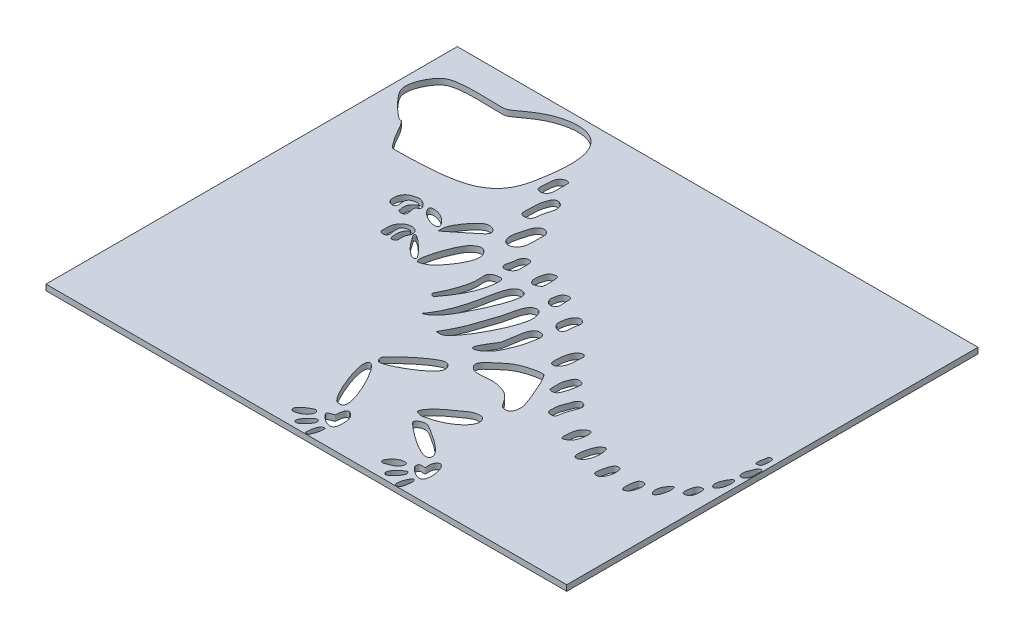
from build123d import *

# Parameters (mm, degrees)
BOSS_EXTRUDE1_DEPTH = 3.81
CUT_EXTRUDE2_DEPTH  = 224.140655074
CUT_EXTRUDE3_DEPTH  = 224.140655216


with BuildPart() as part:
    # Sketch1 → Boss-Extrude1 (new body)
    with BuildSketch(Plane(origin=(0, 0, 0), x_dir=(1, 0, 0), z_dir=(0, 1, 0))):
        Polygon((-169.545, -133.35), (169.545, -133.35), (169.545, 133.35), (169.545, 138.62230863), (-174.81730863, 138.62230863), (-174.81730863, -133.35), align=None)
    extrude(amount=BOSS_EXTRUDE1_DEPTH)

    # Sketch3 → Cut-Extrude2 (cut, through all)
    # profile 1 of 43: a face of its own
    with BuildSketch(Plane(origin=(0, 0, 0), x_dir=(1, 0, 0), z_dir=(0, 1, 0))):
        with BuildLine():
            add(Edge.make_bspline(
                [(-91.542015137, 37.322586792), (-91.65391835, 37.219614613), (-92.324533852, 36.146463954), (-89.862618928, 33.26958076), (-88.397020408, 31.932246621), (-84.173488223, 29.166918066), (-80.500148871, 28.584411737), (-77.971892345, 28.576736995), (-77.500470157, 31.347814716), (-83.496356819, 37.776390769), (-90.724073696, 38.075248049), (-91.542015137, 37.322586792)],
                knots=[0, 0, 0, 0, 0.019939008, 0.179451075, 0.222926196, 0.411215099, 0.451326174, 0.583925878, 0.625876608, 0.854258507, 1, 1, 1, 1], degree=3))
        make_face()
    # profile 2 of 43: a face of its own
    with BuildSketch(Plane(origin=(0, 0, 0), x_dir=(1, 0, 0), z_dir=(0, 1, 0))):
        with BuildLine():
            add(Edge.make_bspline(
                [(-64.465605753, 97.049360345), (-64.928481215, 96.690967494), (-66.440993777, 95.031911487), (-66.815282803, 90.607274201), (-67.28383934, 84.457199381), (-65.528344237, 82.73119463), (-60.948383615, 82.850152494), (-59.773156229, 86.583595001), (-59.873229938, 90.276527545), (-59.677474439, 94.762438544), (-59.777732328, 98.368239523), (-62.727108786, 98.395434907), (-64.465605753, 97.049360345)],
                knots=[0, 0, 0, 0, 0.04219084, 0.15370728, 0.286877941, 0.316430135, 0.449229221, 0.62682008, 0.664290155, 0.806192211, 0.841536971, 1, 1, 1, 1], degree=3))
        make_face()
    # profile 3 of 43: a face of its own
    with BuildSketch(Plane(origin=(0, 0, 0), x_dir=(1, 0, 0), z_dir=(0, 1, 0))):
        with BuildLine():
            add(Edge.make_bspline(
                [(14.503008104, -40.123351811), (14.784918609, -40.408632474), (17.681416759, -43.050216888), (26.977765283, -40.475629658), (36.88783772, -42.795077294), (39.946429394, -44.146076589), (45.121333433, -50.759226507), (46.423695951, -54.222078387), (52.745494658, -52.610973212), (53.448683375, -47.206065657), (51.877457911, -41.203269932), (43.388632106, -20.868490404), (39.242700075, -19.987344993), (27.594806512, -22.481963104), (14.200074455, -33.855216622), (10.967115451, -36.545188591), (14.503008104, -40.123351811)],
                knots=[0, 0, 0, 0, 0.015837931, 0.142541383, 0.177931603, 0.334349907, 0.366262752, 0.465147213, 0.48406968, 0.53656496, 0.553468887, 0.636205025, 0.659820232, 0.766005755, 0.801351051, 1, 1, 1, 1], degree=3))
        make_face()
    # profile 4 of 43: a face of its own
    with BuildSketch(Plane(origin=(0, 0, 0), x_dir=(1, 0, 0), z_dir=(0, 1, 0))):
        with BuildLine():
            add(Edge.make_bspline(
                [(21.227935875, -83.730440807), (21.300473309, -83.791267604), (22.056313977, -84.275855241), (24.632048988, -84.927808514), (29.747397872, -83.57190053), (39.153458634, -81.185635396), (48.294927234, -71.776271451), (47.274908615, -67.058025129), (46.563599695, -65.125405624), (39.333905034, -64.728189349), (34.694670706, -69.426364932), (26.004696402, -74.957304988), (19.386944274, -82.18666381), (21.227935875, -83.730440807)],
                knots=[0, 0, 0, 0, 0.008450928, 0.076058351, 0.110192488, 0.341341371, 0.49116735, 0.514894615, 0.571534092, 0.596921116, 0.743377838, 0.785516435, 1, 1, 1, 1], degree=3))
        make_face()
    # profile 5 of 43: a face of its own
    with BuildSketch(Plane(origin=(0, 0, 0), x_dir=(1, 0, 0), z_dir=(0, 1, 0))):
        with BuildLine():
            add(Edge.make_bspline(
                [(0.528348946, 25.886998649), (0.505540723, 25.710982939), (0.282642067, 24.005189775), (2.570621522, 20.257693993), (6.987295331, 21.591947819), (7.654316072, 25.318925865), (7.250886278, 29.954541047), (7.168397685, 32.122361022), (5.397084842, 32.614817048), (1.223182713, 31.499890851), (0.808439781, 28.048516774), (0.528348946, 25.886998649)],
                knots=[0, 0, 0, 0, 0.02018473, 0.201847299, 0.395048739, 0.435785721, 0.589946966, 0.620753891, 0.713048045, 0.752126333, 1, 1, 1, 1], degree=3))
        make_face()
    # profile 6 of 43: a face of its own
    with BuildSketch(Plane(origin=(0, 0, 0), x_dir=(1, 0, 0), z_dir=(0, 1, 0))):
        with BuildLine():
            add(Edge.make_bspline(
                [(-16.11464107, 29.900272665), (-15.995954189, 29.474736773), (-14.458742174, 25.867545804), (-10.399312478, 28.553035005), (-8.800854843, 29.81754613), (-8.968295772, 38.356758859), (-10.089860529, 40.6949049), (-14.393975608, 39.512575362), (-16.032752546, 34.67183969), (-16.647643111, 31.811279982), (-16.11464107, 29.900272665)],
                knots=[0, 0, 0, 0, 0.042268334, 0.380415008, 0.444917025, 0.622786494, 0.659427082, 0.774682316, 0.810180298, 1, 1, 1, 1], degree=3))
        make_face()
    # profile 7 of 43: a face of its own
    with BuildSketch(Plane(origin=(0, 0, 0), x_dir=(1, 0, 0), z_dir=(0, 1, 0))):
        with BuildLine():
            add(Edge.make_bspline(
                [(-55.897078026, 29.560995971), (-56.281695729, 29.237623882), (-59.892930098, 25.914479253), (-65.348827094, 11.195615076), (-65.892012104, 1.164942712), (-60.702129369, 3.505018313), (-55.699629705, 6.12128485), (-43.745474106, 22.571691345), (-48.718728828, 30.677227321), (-51.981125662, 32.853381338), (-55.897078026, 29.560995971)],
                knots=[0, 0, 0, 0, 0.015507931, 0.139571378, 0.162470174, 0.221597091, 0.288545529, 0.765006118, 0.842107323, 1, 1, 1, 1], degree=3))
        make_face()
    # profile 8 of 43: a face of its own
    with BuildSketch(Plane(origin=(0, 0, 0), x_dir=(1, 0, 0), z_dir=(0, 1, 0))):
        with BuildLine():
            add(Edge.make_bspline(
                [(51.387862225, -114.803893869), (51.382454936, -115.02464443), (51.522810052, -117.252544512), (58.198852632, -121.947186087), (62.294303476, -120.427581674), (63.572660302, -111.464061725), (59.498243913, -104.591906984), (55.321691692, -107.737950785), (55.597026045, -112.859160613), (55.907390911, -113.110216387), (53.563388173, -113.040239128), (51.436528275, -112.817120514), (51.387862225, -114.803893869)],
                knots=[0, 0, 0, 0, 0.017018823, 0.153169411, 0.178134687, 0.249652763, 0.420161936, 0.462199194, 0.67002535, 0.813831713, 0.846829178, 1, 1, 1, 1], degree=3))
        make_face()
    # profile 9 of 43: a face of its own
    with BuildSketch(Plane(origin=(0, 0, 0), x_dir=(1, 0, 0), z_dir=(0, 1, 0))):
        with BuildLine():
            add(Edge.make_bspline(
                [(114.6867528, -59.924818057), (114.729491118, -60.095771327), (115.27666835, -61.237285574), (118.381294228, -61.137338592), (121.421165978, -56.578556254), (121.743281053, -53.534186394), (121.067717316, -48.792781014), (118.753618209, -48.588343635), (116.017751001, -50.429954218), (114.248187844, -58.170558233), (114.6867528, -59.924818057)],
                knots=[0, 0, 0, 0, 0.017057634, 0.153518708, 0.216852434, 0.587061175, 0.650554742, 0.788294535, 0.824960808, 1, 1, 1, 1], degree=3))
        make_face()
    # profile 10 of 43: a face of its own
    with BuildSketch(Plane(origin=(0, 0, 0), x_dir=(1, 0, 0), z_dir=(0, 1, 0))):
        with BuildLine():
            add(Edge.make_bspline(
                [(-4.062132727, -132.417419648), (-4.055925816, -132.460276796), (-3.995496856, -132.83788407), (-2.074927879, -133.311557533), (-0.468516826, -129.379969418), (0.1790829, -127.156761212), (0.38630734, -123.038001402), (-1.777009786, -123.942012355), (-3.322641715, -125.450791586), (-4.366161003, -130.318181466), (-4.062132727, -132.417419648)],
                knots=[0, 0, 0, 0, 0.009256087, 0.083304785, 0.118716357, 0.327960231, 0.368328179, 0.482027886, 0.546616315, 1, 1, 1, 1], degree=3))
        make_face()
    # profile 11 of 43: a face of its own
    with BuildSketch(Plane(origin=(0, 0, 0), x_dir=(1, 0, 0), z_dir=(0, 1, 0))):
        with BuildLine():
            add(Edge.make_bspline(
                [(37.896352596, -11.861878545), (38.021586866, -11.949542534), (39.285826174, -12.170741801), (40.555392075, -12.326721646), (44.832936323, -6.803541624), (44.308296583, -2.390571595), (45.200161781, 4.120933438), (41.900628824, 4.834576407), (37.043512324, -1.087301561), (36.557927918, -10.92498127), (37.896352596, -11.861878545)],
                knots=[0, 0, 0, 0, 0.020780416, 0.187023747, 0.240790841, 0.504684265, 0.55922741, 0.731679145, 0.777912051, 1, 1, 1, 1], degree=3))
        make_face()
    # profile 12 of 43: a face of its own
    with BuildSketch(Plane(origin=(0, 0, 0), x_dir=(1, 0, 0), z_dir=(0, 1, 0))):
        with BuildLine():
            add(Edge.make_bspline(
                [(163.492515477, 6.34287981), (163.324497697, 6.123428016), (162.947928924, 3.256530552), (161.889045776, 0.279355237), (162.840029989, -1.956108104), (163.815199152, -1.498796138), (166.092000241, -0.926971014), (166.292095404, 3.154359675), (166.273456546, 6.687158303), (163.980310696, 6.980000096), (163.492515477, 6.34287981)],
                knots=[0, 0, 0, 0, 0.03326737, 0.299406326, 0.353220498, 0.517594919, 0.573596104, 0.857231157, 0.903416985, 1, 1, 1, 1], degree=3))
        make_face()
    # profile 13 of 43: a face of its own
    with BuildSketch(Plane(origin=(0, 0, 0), x_dir=(1, 0, 0), z_dir=(0, 1, 0))):
        with BuildLine():
            add(Edge.make_bspline(
                [(149.250099333, -41.947484614), (149.112602169, -41.873290304), (147.486566068, -42.154554618), (143.082368883, -48.26832991), (146.687679051, -56.040891514), (150.475980161, -47.460631502), (149.678225908, -42.17850433), (149.250099333, -41.947484614)],
                knots=[0, 0, 0, 0, 0.035839077, 0.358390766, 0.518048392, 0.888407435, 1, 1, 1, 1], degree=3))
        make_face()
    # profile 14 of 43: a face of its own
    with BuildSketch(Plane(origin=(0, 0, 0), x_dir=(1, 0, 0), z_dir=(0, 1, 0))):
        with BuildLine():
            add(Edge.make_bspline(
                [(-79.98393803, 16.753249035), (-80.081010975, 16.804943504), (-80.930915658, 17.23682462), (-81.941957742, 16.697682781), (-75.814186935, 7.703624546), (-72.590575365, 5.316326099), (-69.38511458, 3.007902086), (-67.151603708, 2.99090111), (-67.061756876, 5.770904446), (-76.209431856, 14.74320294), (-79.98393803, 16.753249035)],
                knots=[0, 0, 0, 0, 0.004766014, 0.042894126, 0.109883005, 0.607665921, 0.682309035, 0.781671031, 0.814682152, 1, 1, 1, 1], degree=3))
        make_face()
    # profile 15 of 43: a face of its own
    with BuildSketch(Plane(origin=(0, 0, 0), x_dir=(1, 0, 0), z_dir=(0, 1, 0))):
        with BuildLine():
            add(Edge.make_bspline(
                [(16.803913905, 15.294425326), (16.754957699, 14.823466123), (16.449667367, 10.94963843), (21.405877953, 8.195306275), (24.735032391, 12.315189368), (23.361824106, 12.783664316), (25.658708788, 22.128843056), (22.160061855, 24.127497735), (17.744419103, 21.428220159), (17.043006767, 17.594501107), (16.803913905, 15.294425326)],
                knots=[0, 0, 0, 0, 0.035053188, 0.315478688, 0.385774496, 0.667715456, 0.713640808, 0.799102661, 0.828806853, 1, 1, 1, 1], degree=3))
        make_face()
    # profile 16 of 43: a face of its own
    with BuildSketch(Plane(origin=(0, 0, 0), x_dir=(1, 0, 0), z_dir=(0, 1, 0))):
        with BuildLine():
            add(Edge.make_bspline(
                [(-33.716806314, -25.510766217), (-33.795983845, -25.59262967), (-33.972322493, -25.693579689), (-30.748658466, -26.108813315), (-20.77783359, -13.179075112), (-9.203609991, 12.129244185), (-10.705794687, 20.064484295), (-17.509488953, 21.092286771), (-20.533417018, 13.203205411), (-25.419478303, -15.926894582), (-32.937275102, -24.704791132), (-33.716806314, -25.510766217)],
                knots=[0, 0, 0, 0, 0.029366847, 0.264301623, 0.315128072, 0.486804886, 0.514976536, 0.57538497, 0.668411345, 0.710872848, 1, 1, 1, 1], degree=3))
        make_face()
    # profile 17 of 43: a face of its own
    with BuildSketch(Plane(origin=(0, 0, 0), x_dir=(1, 0, 0), z_dir=(0, 1, 0))):
        with BuildLine():
            add(Edge.make_bspline(
                [(-75.656405604, 26.734733156), (-75.685258919, 26.581397222), (-76.17906958, 26.132819734), (-64.525462372, 35.502113407), (-54.693486016, 43.470265177), (-60.026962236, 47.369309442), (-66.638632959, 45.950973373), (-73.409271294, 36.388761793), (-75.825004315, 30.467137167), (-75.538425057, 27.361720295), (-75.656405604, 26.734733156)],
                knots=[0, 0, 0, 0, 0.035008556, 0.350085557, 0.465041353, 0.595637251, 0.633227651, 0.817865604, 0.856850814, 1, 1, 1, 1], degree=3))
        make_face()
    # profile 18 of 43: a face of its own
    with BuildSketch(Plane(origin=(0, 0, 0), x_dir=(1, 0, 0), z_dir=(0, 1, 0))):
        with BuildLine():
            add(Edge.make_bspline(
                [(155.096829505, -41.695622461), (155.207780619, -43.17127227), (157.821411323, -42.859237855), (159.996207355, -40.754596534), (160.656927203, -40.131757401), (160.662796845, -34.751027581), (160.543788755, -33.219867635), (154.911594471, -32.73358886), (154.983260895, -40.185159946), (155.096829505, -41.695622461)],
                knots=[0, 0, 0, 0, 0.323078917, 0.323078917, 0.615276181, 0.615276181, 0.669299186, 0.669299186, 1, 1, 1, 1], degree=3))
        make_face()
    # profile 19 of 43: a face of its own
    with BuildSketch(Plane(origin=(0, 0, 0), x_dir=(1, 0, 0), z_dir=(0, 1, 0))):
        with BuildLine():
            add(Edge.make_bspline(
                [(133.833634158, -60.416338349), (134.187174924, -60.482704728), (138.169435027, -59.201922768), (139.031280462, -51.605372257), (137.224017338, -49.091489431), (135.53091519, -49.355491983), (133.001548566, -50.565103145), (131.721307256, -60.019814098), (133.833634158, -60.416338349)],
                knots=[0, 0, 0, 0, 0.044939449, 0.404455044, 0.474621361, 0.676436303, 0.731496854, 1, 1, 1, 1], degree=3))
        make_face()
    # profile 20 of 43: a face of its own
    with BuildSketch(Plane(origin=(0, 0, 0), x_dir=(1, 0, 0), z_dir=(0, 1, 0))):
        with BuildLine():
            add(Edge.make_bspline(
                [(-56.542867789, 80.4090043), (-57.360025214, 78.432618613), (-58.194406257, 75.799332909), (-58.028803939, 68.474487513), (-58.986863676, 62.510504472), (-50.550479214, 63.678043941), (-51.45089827, 70.740916465), (-48.809310938, 75.846646023), (-48.957240293, 82.478753936), (-54.550262466, 84.612947751), (-55.936102592, 81.876533097), (-56.542867789, 80.4090043)],
                knots=[0, 0, 0, 0, 0.196712415, 0.227714318, 0.310019024, 0.419059956, 0.530055008, 0.660864195, 0.693252176, 0.853934819, 1, 1, 1, 1], degree=3))
        make_face()
    # profile 21 of 43: a face of its own
    with BuildSketch(Plane(origin=(0, 0, 0), x_dir=(1, 0, 0), z_dir=(0, 1, 0))):
        with BuildLine():
            add(Edge.make_bspline(
                [(-48.508391937, 45.499040123), (-48.379947717, 45.070892724), (-46.797809852, 41.31172592), (-43.023725639, 41.318782715), (-37.414567081, 46.012551944), (-38.007343737, 51.105896691), (-37.486169202, 62.913519191), (-43.281495409, 63.534466695), (-46.324042342, 58.818036159), (-47.064314202, 56.03746806), (-48.457455762, 50.709133163), (-49.153314986, 47.648783622), (-48.508391937, 45.499040123)],
                knots=[0, 0, 0, 0, 0.018862865, 0.169765788, 0.224468424, 0.511186589, 0.5669401, 0.726250019, 0.761023924, 0.87990525, 0.905288874, 1, 1, 1, 1], degree=3))
        make_face()
    # profile 22 of 43: a face of its own
    with BuildSketch(Plane(origin=(0, 0, 0), x_dir=(1, 0, 0), z_dir=(0, 1, 0))):
        with BuildLine():
            add(Edge.make_bspline(
                [(99.468289653, -57.571944512), (100.38729169, -57.988757795), (102.560142419, -57.361954265), (106.795538312, -51.009410446), (106.038905479, -40.492027762), (101.437501136, -43.466570073), (99.422569256, -46.306023928), (97.285986301, -56.582161044), (99.468289653, -57.571944512)],
                knots=[0, 0, 0, 0, 0.115048732, 0.164424759, 0.457167438, 0.517064259, 0.726800135, 1, 1, 1, 1], degree=3))
        make_face()
    # profile 23 of 43: a face of its own
    with BuildSketch(Plane(origin=(0, 0, 0), x_dir=(1, 0, 0), z_dir=(0, 1, 0))):
        with BuildLine():
            add(Edge.make_bspline(
                [(164.508977119, -13.721623532), (164.636894472, -13.84069279), (165.90747669, -14.489105315), (168.210257852, -13.267957268), (169.304803184, -9.944112583), (168.927783157, -6.494696115), (169.066671934, -2.793228643), (165.865254448, -3.115253922), (165.323141054, -6.655725913), (163.39839929, -10.171032453), (163.748447482, -13.013700037), (164.508977119, -13.721623532)],
                knots=[0, 0, 0, 0, 0.025273086, 0.227457777, 0.285534496, 0.547963553, 0.592733479, 0.700430126, 0.819782467, 0.849739455, 1, 1, 1, 1], degree=3))
        make_face()
    # profile 24 of 43: a face of its own
    with BuildSketch(Plane(origin=(0, 0, 0), x_dir=(1, 0, 0), z_dir=(0, 1, 0))):
        with BuildLine():
            add(Edge.make_bspline(
                [(160.661880967, -27.208216991), (160.679526674, -27.340861389), (160.903231282, -28.426409673), (162.615031879, -30.031500451), (164.498509592, -27.307766588), (165.696084114, -26.467349911), (166.315844112, -20.26097831), (165.308222188, -16.534954882), (161.360471491, -21.839701376), (160.482281831, -25.858153854), (160.661880967, -27.208216991)],
                knots=[0, 0, 0, 0, 0.019318757, 0.173868812, 0.232992094, 0.551428296, 0.601673612, 0.695640725, 0.803372461, 1, 1, 1, 1], degree=3))
        make_face()
    # profile 25 of 43: a face of its own
    with BuildSketch(Plane(origin=(0, 0, 0), x_dir=(1, 0, 0), z_dir=(0, 1, 0))):
        with BuildLine():
            add(Edge.make_bspline(
                [(-23.364075202, -71.605579889), (-23.694004458, -71.90397718), (-25.945628569, -76.754279406), (-14.824389788, -103.344156371), (-9.385384732, -105.166691161), (-6.182117533, -104.826126296), (-7.529771535, -92.024141264), (-20.125445229, -68.676471934), (-23.364075202, -71.605579889)],
                knots=[0, 0, 0, 0, 0.039948341, 0.359535068, 0.415964147, 0.547810052, 0.607861711, 1, 1, 1, 1], degree=3))
        make_face()
    # profile 26 of 43: a face of its own
    with BuildSketch(Plane(origin=(0, 0, 0), x_dir=(1, 0, 0), z_dir=(0, 1, 0))):
        with BuildLine():
            add(Edge.make_bspline(
                [(64.166924047, -39.25050065), (64.168506595, -39.396095037), (64.187957897, -40.885006937), (69.503167719, -42.172708808), (69.748225136, -38.199952527), (71.072778473, -31.805800156), (73.662890804, -27.536148012), (72.528725749, -24.612319278), (68.029972196, -22.438639865), (65.104519885, -32.751817814), (64.098261992, -32.933591609), (64.166924047, -39.25050065)],
                knots=[0, 0, 0, 0, 0.00740117, 0.074011699, 0.145377231, 0.175107865, 0.349516909, 0.381549495, 0.47363259, 0.67888517, 1, 1, 1, 1], degree=3))
        make_face()
    # profile 27 of 43: a face of its own
    with BuildSketch(Plane(origin=(0, 0, 0), x_dir=(1, 0, 0), z_dir=(0, 1, 0))):
        with BuildLine():
            add(Edge.make_bspline(
                [(83.62883511, -46.358616375), (83.408736561, -48.437118146), (83.095544077, -52.064796051), (88.758266548, -49.410311789), (90.752310321, -45.298539519), (91.195920449, -36.282309661), (84.532483456, -39.692868448), (84.00649782, -42.792156642), (83.62883511, -46.358616375)],
                knots=[0, 0, 0, 0, 0.14952472, 0.215411048, 0.467106659, 0.650036615, 0.743433515, 1, 1, 1, 1], degree=3))
        make_face()
    # profile 28 of 43: a face of its own
    with BuildSketch(Plane(origin=(0, 0, 0), x_dir=(1, 0, 0), z_dir=(0, 1, 0))):
        with BuildLine():
            add(Edge.make_bspline(
                [(25.497417042, -90.954494738), (25.664827867, -91.489087835), (30.552911299, -96.227292212), (48.486382242, -109.380433835), (54.725302478, -102.045838071), (39.539129351, -91.98322093), (30.012026201, -86.519823842), (24.955438972, -89.223795815), (25.497417042, -90.954494738)],
                knots=[0, 0, 0, 0, 0.038709293, 0.348383636, 0.434459415, 0.813391305, 0.874682012, 1, 1, 1, 1], degree=3))
        make_face()
    # profile 29 of 43: a face of its own
    with BuildSketch(Plane(origin=(0, 0, 0), x_dir=(1, 0, 0), z_dir=(0, 1, 0))):
        with BuildLine():
            add(Edge.make_bspline(
                [(4.051690369, -29.187445569), (4.379148576, -29.128001778), (7.870292683, -28.110765579), (12.468562593, -23.113351284), (16.629210697, -13.49025151), (18.176731192, -9.419349569), (19.940882766, 2.523261344), (15.198444153, 2.682902044), (10.757919011, -0.108618811), (10.645338166, -7.422098379), (8.258097358, -18.644881305), (9.97745686, -13.330416283), (0.932009995, -29.753764025), (4.051690369, -29.187445569)],
                knots=[0, 0, 0, 0, 0.008074965, 0.072674686, 0.099349961, 0.24815244, 0.27522562, 0.343008583, 0.384517974, 0.648810145, 0.705969015, 0.923070152, 1, 1, 1, 1], degree=3))
        make_face()
    # profile 30 of 43: a face of its own
    with BuildSketch(Plane(origin=(0, 0, 0), x_dir=(1, 0, 0), z_dir=(0, 1, 0))):
        with BuildLine():
            add(Edge.make_bspline(
                [(-14.331361336, -128.330665924), (-14.348704903, -128.459779145), (-14.402513724, -129.56547153), (-12.915760325, -130.361208959), (-9.85656431, -128.711061811), (-6.546091977, -124.729998531), (-6.115750506, -122.795474684), (-6.402967037, -121.387883004), (-8.703491355, -120.2501599), (-13.996507461, -125.837864856), (-14.331361336, -128.330665924)],
                knots=[0, 0, 0, 0, 0.015961604, 0.143654439, 0.194995899, 0.478034742, 0.527831783, 0.643169269, 0.691827809, 1, 1, 1, 1], degree=3))
        make_face()
    # profile 31 of 43: a face of its own
    with BuildSketch(Plane(origin=(0, 0, 0), x_dir=(1, 0, 0), z_dir=(0, 1, 0))):
        with BuildLine():
            add(Edge.make_bspline(
                [(-94.210826462, 34.03206876), (-93.778868206, 35.565427326), (-97.971608348, 39.889797899), (-105.04532316, 38.256139321), (-109.262624582, 36.339915398), (-110.014173652, 26.560828394), (-102.197140196, 25.93291178), (-105.239181187, 33.828881051), (-101.408424888, 35.947325289), (-98.038525023, 36.043633356), (-96.765829547, 35.429407157), (-97.223215311, 34.525777818), (-101.091935193, 32.411883608), (-100.879123663, 28.049951437), (-100.076511258, 24.388555366), (-93.782562734, 24.75578378), (-96.873371051, 29.781422296), (-96.158039742, 32.878034999), (-94.434404055, 33.238416566), (-94.210826462, 34.03206876)],
                knots=[0, 0, 0, 0, 0.094856815, 0.116602415, 0.217456002, 0.292256507, 0.349905874, 0.420597596, 0.490923361, 0.502433042, 0.531998702, 0.545686405, 0.635614364, 0.729475404, 0.747475955, 0.81561987, 0.932464978, 0.950902991, 1, 1, 1, 1], degree=3))
        make_face()
    # profile 32 of 43: a face of its own
    with BuildSketch(Plane(origin=(0, 0, 0), x_dir=(1, 0, 0), z_dir=(0, 1, 0))):
        with BuildLine():
            add(Edge.make_bspline(
                [(-32.296392677, 19.815291487), (-32.743265322, 19.611297579), (-36.049599472, 17.573556984), (-32.14109701, 11.124366865), (-39.587678183, -7.107494929), (-42.387618115, -11.275585907), (-39.793500224, -12.903958032), (-37.686612077, -9.871203555), (-27.514981128, 2.832637203), (-25.802626652, 19.536052323), (-28.375004488, 21.094564998), (-31.060179705, 20.379613152), (-32.296392677, 19.815291487)],
                knots=[0, 0, 0, 0, 0.025581572, 0.255815716, 0.500363414, 0.535000104, 0.594717894, 0.623341296, 0.813769401, 0.910608969, 0.929232029, 1, 1, 1, 1], degree=3))
        make_face()
    # profile 33 of 43: a face of its own
    with BuildSketch(Plane(origin=(0, 0, 0), x_dir=(1, 0, 0), z_dir=(0, 1, 0))):
        with BuildLine():
            add(Edge.make_bspline(
                [(-34.156804193, 28.821109473), (-34.096521909, 28.552216051), (-33.10153179, 25.785483769), (-26.335462911, 27.898336909), (-26.828655281, 34.685333217), (-26.297707828, 41.042372118), (-32.106437564, 40.446546104), (-33.133040078, 36.103895352), (-33.361864835, 31.919022497), (-34.501041184, 30.356603084), (-34.156804193, 28.821109473)],
                knots=[0, 0, 0, 0, 0.023977596, 0.239775963, 0.366940947, 0.500447341, 0.700245757, 0.833102498, 0.863077923, 1, 1, 1, 1], degree=3))
        make_face()
    # profile 34 of 43: a face of its own
    with BuildSketch(Plane(origin=(0, 0, 0), x_dir=(1, 0, 0), z_dir=(0, 1, 0))):
        with BuildLine():
            add(Edge.make_bspline(
                [(37.731420674, -121.996558791), (37.640202855, -122.154746655), (36.826967853, -123.614772993), (38.514858827, -124.757899796), (42.329418833, -123.130014526), (46.991296946, -122.172807504), (47.605359889, -116.752003995), (43.953987237, -116.128715108), (40.276714704, -117.582567879), (37.731420674, -121.996558791)],
                knots=[0, 0, 0, 0, 0.012393179, 0.111538615, 0.16164663, 0.501080148, 0.604295256, 0.654187241, 1, 1, 1, 1], degree=3))
        make_face()
    # profile 35 of 43: a face of its own
    with BuildSketch(Plane(origin=(0, 0, 0), x_dir=(1, 0, 0), z_dir=(0, 1, 0))):
        with BuildLine():
            add(Edge.make_bspline(
                [(45.262403398, -128.069825788), (45.235297006, -128.165666247), (45.011462115, -129.034746232), (46.1881916, -130.602872315), (48.942998782, -129.314572062), (51.948054537, -126.270149073), (53.458300274, -122.528744044), (52.315598044, -120.644263754), (48.619061476, -123.189465498), (45.984183052, -125.517819155), (45.262403398, -128.069825788)],
                knots=[0, 0, 0, 0, 0.014619941, 0.131579469, 0.176264738, 0.416787361, 0.458912449, 0.555390528, 0.610705259, 1, 1, 1, 1], degree=3))
        make_face()
    # profile 36 of 43: a face of its own
    with BuildSketch(Plane(origin=(0, 0, 0), x_dir=(1, 0, 0), z_dir=(0, 1, 0))):
        with BuildLine():
            add(Edge.make_bspline(
                [(-21.568989617, -63.743442059), (-21.660736115, -63.849561767), (-22.365187762, -64.678646665), (-21.551626997, -67.986190401), (-15.443103305, -67.98079859), (6.185601351, -55.93173735), (6.024944033, -48.258298832), (3.052508677, -44.763006251), (-10.004307568, -51.224699281), (-19.575391382, -61.437522292), (-21.568989617, -63.743442059)],
                knots=[0, 0, 0, 0, 0.014580203, 0.131221828, 0.185135605, 0.499804195, 0.55002184, 0.63709441, 0.683180633, 1, 1, 1, 1], degree=3))
        make_face()
    # profile 37 of 43: a face of its own
    with BuildSketch(Plane(origin=(0, 0, 0), x_dir=(1, 0, 0), z_dir=(0, 1, 0))):
        with BuildLine():
            add(Edge.make_bspline(
                [(-82.314922661, 16.753249035), (-82.383878665, 17.751158861), (-83.559677059, 20.896079441), (-88.30581655, 20.766636749), (-92.451412596, 18.628269782), (-94.475335864, 15.347042899), (-94.414040672, 10.390296426), (-94.806744403, 7.438220669), (-92.948660697, 6.821567639), (-90.978201797, 6.663028114), (-88.69498132, 9.382893521), (-90.7529198, 10.949057132), (-89.789435433, 17.576805895), (-82.628118517, 18.127069137), (-88.326221601, 16.02127275), (-87.864825992, 6.718148999), (-85.515175124, 6.579651856), (-83.862281231, 7.50213238), (-83.719520576, 10.319262502), (-84.214818349, 13.436026652), (-82.21100909, 15.249444172), (-82.314922661, 16.753249035)],
                knots=[0, 0, 0, 0, 0.047068315, 0.11231218, 0.130974699, 0.222280304, 0.240811144, 0.297752264, 0.310302931, 0.353767144, 0.375791751, 0.5085244, 0.532567077, 0.599626945, 0.665496137, 0.752070288, 0.767913803, 0.817707129, 0.834445184, 0.929070183, 1, 1, 1, 1], degree=3))
        make_face()
    # profile 38 of 43: a face of its own
    with BuildSketch(Plane(origin=(0, 0, 0), x_dir=(1, 0, 0), z_dir=(0, 1, 0))):
        with BuildLine():
            add(Edge.make_bspline(
                [(51.954326414, -26.214853249), (51.956569414, -26.354270045), (51.976510184, -27.633767537), (55.369981158, -27.705971171), (58.395839586, -24.73606195), (59.774457896, -16.723190922), (60.112992998, -12.920678418), (54.85256074, -10.974796738), (53.403889375, -14.953383971), (51.687853752, -19.160418705), (51.858549415, -20.261698297), (51.954326414, -26.214853249)],
                knots=[0, 0, 0, 0, 0.006884839, 0.061963551, 0.094777735, 0.302212496, 0.344797669, 0.494700117, 0.655484536, 0.706014524, 1, 1, 1, 1], degree=3))
        make_face()
    # profile 39 of 43: a face of its own
    with BuildSketch(Plane(origin=(0, 0, 0), x_dir=(1, 0, 0), z_dir=(0, 1, 0))):
        with BuildLine():
            add(Edge.make_bspline(
                [(0.28957124, -107.053757633), (-2.308691995, -104.884724033), (-4.299099327, -108.818200527), (-4.225536422, -112.45976951), (-4.399989959, -112.663544572), (-7.447735166, -113.725464194), (-9.438563979, -115.434714117), (-1.307245601, -122.152633545), (3.370438052, -119.363425445), (3.278488492, -114.698567828), (2.70652962, -109.541471075), (1.233741225, -107.84195199), (0.28957124, -107.053757633)],
                knots=[0, 0, 0, 0, 0.224541592, 0.449658485, 0.483563932, 0.554703602, 0.584878077, 0.755134209, 0.789708485, 0.896046568, 0.918404945, 1, 1, 1, 1], degree=3))
        make_face()
    # profile 40 of 43: a face of its own
    with BuildSketch(Plane(origin=(0, 0, 0), x_dir=(1, 0, 0), z_dir=(0, 1, 0))):
        with BuildLine():
            add(Edge.make_bspline(
                [(58.312887738, -123.422779511), (58.083347813, -123.455305247), (56.710105892, -125.242402943), (54.820065602, -129.226849343), (55.352246188, -132.735007236), (56.485014413, -133.368005938), (59.390378071, -131.546074626), (59.240451204, -128.95565236), (59.945853838, -124.279977972), (58.783226509, -123.356132653), (58.312887738, -123.422779511)],
                knots=[0, 0, 0, 0, 0.045548698, 0.409938285, 0.466513374, 0.5547245, 0.598805629, 0.863243531, 0.906668442, 1, 1, 1, 1], degree=3))
        make_face()
    # profile 41 of 43: a face of its own
    with BuildSketch(Plane(origin=(0, 0, 0), x_dir=(1, 0, 0), z_dir=(0, 1, 0))):
        with BuildLine():
            add(Edge.make_bspline(
                [(-21.847744238, -121.996558791), (-22.229639471, -122.967119181), (-21.53627492, -124.443974361), (-17.853217568, -124.488200499), (-12.520427048, -121.78179093), (-11.919408837, -116.922031449), (-13.406657796, -115.673292231), (-17.093180118, -117.471720549), (-20.294620736, -119.465457054), (-21.746772149, -121.739945193), (-21.847744238, -121.996558791)],
                knots=[0, 0, 0, 0, 0.126684623, 0.182310092, 0.51470529, 0.567134142, 0.654169757, 0.698544288, 0.966504921, 1, 1, 1, 1], degree=3))
        make_face()
    # profile 42 of 43: a face of its own
    with BuildSketch(Plane(origin=(0, 0, 0), x_dir=(1, 0, 0), z_dir=(0, 1, 0))):
        with BuildLine():
            Line((-18.663665482, -31.590942523), (-15.653411961, -31.590942523))
            add(Edge.make_bspline(
                [(-15.653411961, -31.590942523), (-10.285376125, -31.914622908), (6.578012984, -2.173647935), (5.850893328, 11.601493139), (3.72843688, 15.057604688), (-3.805047217, 14.041138452), (-4.488974589, 2.72896218), (-11.887709825, -17.025086616), (-10.88729594, -17.969812468), (-18.663665482, -31.590942523)],
                knots=[0, 0, 0, 0, 0.255506378, 0.293204724, 0.36767471, 0.400617206, 0.589687186, 0.65198884, 1, 1, 1, 1], degree=3))
        make_face()
    # profile 43 of 43: a face of its own
    with BuildSketch(Plane(origin=(0, 0, 0), x_dir=(1, 0, 0), z_dir=(0, 1, 0))):
        with BuildLine():
            Line((-119.144235873, 82.418218659), (-126.927391254, 73.630096189))
            Line((-126.927391254, 73.630096189), (-137.010115272, 81.884957958))
            Line((-137.010115272, 81.884957958), (-141.078582858, 71.625344046))
            Line((-141.078582858, 71.625344046), (-148.213141957, 74.278692471))
            add(Edge.make_bspline(
                [(-148.213141957, 74.278692471), (-143.487701839, 65.321841207), (-138.714650928, 58.943582801), (-136.373353199, 58.878397958), (-112.760951188, 59.332254084), (-91.362253532, 61.468029865), (-75.677999243, 73.237046333), (-70.613094317, 92.129618701), (-68.235387303, 123.523387208), (-86.380569194, 135.787581046), (-107.591163276, 131.24608797), (-120.992041717, 119.029571956), (-128.691399367, 118.165652673), (-148.463207606, 119.984560459), (-161.631910058, 116.44744683), (-167.461453696, 108.696394479), (-170.136693045, 99.81123495), (-167.60031958, 91.269354347), (-157.046995219, 81.178871001), (-153.265031965, 78.441970827), (-151.369249095, 77.523213613), (-150.925453681, 77.934416969)],
                knots=[0, 0, 0, 0, 0.018984348, 0.022838084, 0.038537356, 0.169302771, 0.266187522, 0.380411101, 0.502569533, 0.526558927, 0.620305042, 0.676480259, 0.697255758, 0.813526223, 0.832887641, 0.876336133, 0.925656276, 0.937589147, 0.989211991, 0.996098362, 1, 1, 1, 1], degree=3))
            Line((-150.925453681, 77.934416969), (-138.246921637, 90.392648083))
            Line((-138.246921637, 90.392648083), (-128.103478181, 81.884957958))
            Line((-128.103478181, 81.884957958), (-119.899842788, 89.623240357))
            Line((-119.899842788, 89.623240357), (-109.21215765, 83.225654668))
            add(Edge.make_bspline(
                [(-109.21215765, 83.225654668), (-97.916033864, 84.974493108), (-94.583753537, 101.704817267), (-94.420630711, 89.744668369), (-96.554857141, 79.669431837), (-110.889374104, 76.401371212)],
                knots=[0, 0, 0, 0, 0.274097447, 0.374097447, 1, 1, 1, 1], degree=3))
            Line((-110.889374104, 76.401371212), (-119.144235873, 82.418218659))
        make_face()
        with BuildLine():
            add(Edge.make_bspline(
                [(-117.024847802, 110.388110498), (-117.716419908, 109.192543284), (-115.903515897, 107.129919211), (-109.92584919, 107.475881667), (-111.527359297, 104.061440531), (-109.827516076, 101.822969562), (-103.023830852, 105.776755374), (-110.325563337, 115.737133194), (-116.294752446, 111.650275446), (-117.024847802, 110.388110498)],
                knots=[0, 0, 0, 0, 0.145822988, 0.342644759, 0.499469641, 0.526279666, 0.610745011, 0.846054106, 1, 1, 1, 1], degree=3))
        make_face(mode=Mode.SUBTRACT)
        with BuildLine():
            add(Edge.make_bspline(
                [(-103.812131332, 117.760811374), (-103.706341288, 117.454871245), (-102.573190929, 114.612577627), (-96.012516902, 116.622035782), (-95.789362747, 112.092983455), (-98.512049332, 108.506985763), (-98.154526442, 104.575036296), (-92.020559929, 103.476034211), (-81.586057452, 107.857952581), (-78.440052596, 116.376358471), (-80.854491553, 124.883799222), (-85.498566503, 127.927813624), (-94.354492862, 127.201880801), (-106.474304315, 125.459697882), (-103.812131332, 117.760811374)],
                knots=[0, 0, 0, 0, 0.007009998, 0.063089978, 0.075821331, 0.127313532, 0.164213847, 0.194635247, 0.431527533, 0.621159699, 0.65840646, 0.787818624, 0.82359563, 1, 1, 1, 1], degree=3))
        make_face(mode=Mode.SUBTRACT)
        with BuildLine():
            Line((-159.259731721, 106.444626113), (-159.674696805, 106.043598109))
            add(Edge.make_bspline(
                [(-159.674696805, 106.043598109), (-154.551671515, 105.997777946), (-151.031534908, 105.343403708), (-145.539374708, 103.675445116), (-142.275964132, 108.365125954), (-146.121613388, 113.754099074), (-155.153372973, 112.418726424), (-156.205063851, 109.796275581), (-159.259731721, 106.444626113)],
                knots=[0, 0, 0, 0, 0.249242272, 0.292414961, 0.431726888, 0.617682412, 0.674509723, 1, 1, 1, 1], degree=3))
        make_face(mode=Mode.SUBTRACT)
    extrude(amount=CUT_EXTRUDE2_DEPTH, mode=Mode.SUBTRACT)


with BuildPart() as cut_extrude2_piece_1:
    # of the separate pieces the step leaves, piece 1, a body of its own (cut_extrude2_pieces)
    add(part.part.solids().sort_by_distance((169.545, 0, 133.35))[0])


with BuildPart() as cut_extrude2_piece_2:
    # of the separate pieces the step leaves, piece 2, a body of its own (cut_extrude2_pieces)
    add(part.part.solids().sort_by_distance((-103.812131332, 0, -117.760811374))[0])


with BuildPart() as cut_extrude2_piece_3:
    # of the separate pieces the step leaves, piece 3, a body of its own (cut_extrude2_pieces)
    add(part.part.solids().sort_by_distance((-159.259731721, 0, -106.444626113))[0])


with BuildPart() as cut_extrude2_piece_4:
    # of the separate pieces the step leaves, piece 4, a body of its own (cut_extrude2_pieces)
    add(part.part.solids().sort_by_distance((-117.024847802, 0, -110.388110498))[0])


with BuildPart() as cut_extrude3_tool:
    # Sketch4 → Cut-Extrude3 (new, through all)
    with BuildSketch(Plane(origin=(0, 3.81, 0), x_dir=(1, 0, 0), z_dir=(0, 1, 0))):
        with BuildLine():
            Line((-150.925453681, 77.934416969), (-148.213141957, 74.278692471))
            add(Edge.make_bspline(
                [(-148.213141957, 74.278692471), (-143.487701839, 65.321841207), (-138.714650928, 58.943582801), (-136.373353199, 58.878397958), (-112.760951188, 59.332254084), (-91.362253532, 61.468029865), (-75.677999243, 73.237046333), (-70.613094317, 92.129618701), (-68.235387303, 123.523387208), (-86.380569194, 135.787581046), (-107.591163276, 131.24608797), (-120.992041717, 119.029571956), (-128.691399367, 118.165652673), (-148.463207606, 119.984560459), (-161.631910058, 116.44744683), (-167.461453696, 108.696394479), (-170.136693045, 99.81123495), (-167.60031958, 91.269354347), (-157.046995219, 81.178871001), (-153.265031965, 78.441970827), (-151.369249095, 77.523213613), (-150.925453681, 77.934416969)],
                knots=[0, 0, 0, 0, 0.018984348, 0.022838084, 0.038537356, 0.169302771, 0.266187522, 0.380411101, 0.502569533, 0.526558927, 0.620305042, 0.676480259, 0.697255758, 0.813526223, 0.832887641, 0.876336133, 0.925656276, 0.937589147, 0.989211991, 0.996098362, 1, 1, 1, 1], degree=3))
        make_face()
    extrude(amount=-CUT_EXTRUDE3_DEPTH)


with BuildPart() as cut_extrude2_piece_1_1:
    add(cut_extrude2_piece_1.part)

    # Cut-Extrude3: cut by cut_extrude3_tool
    add(cut_extrude3_tool.part, mode=Mode.SUBTRACT)


with BuildPart() as cut_extrude2_piece_2_1:
    add(cut_extrude2_piece_2.part)

    # Cut-Extrude3: cut by cut_extrude3_tool
    add(cut_extrude3_tool.part, mode=Mode.SUBTRACT)


with BuildPart() as cut_extrude2_piece_3_1:
    add(cut_extrude2_piece_3.part)

    # Cut-Extrude3: cut by cut_extrude3_tool
    add(cut_extrude3_tool.part, mode=Mode.SUBTRACT)


with BuildPart() as cut_extrude2_piece_4_1:
    add(cut_extrude2_piece_4.part)

    # Cut-Extrude3: cut by cut_extrude3_tool
    add(cut_extrude3_tool.part, mode=Mode.SUBTRACT)


solid = cut_extrude2_piece_1_1.part
